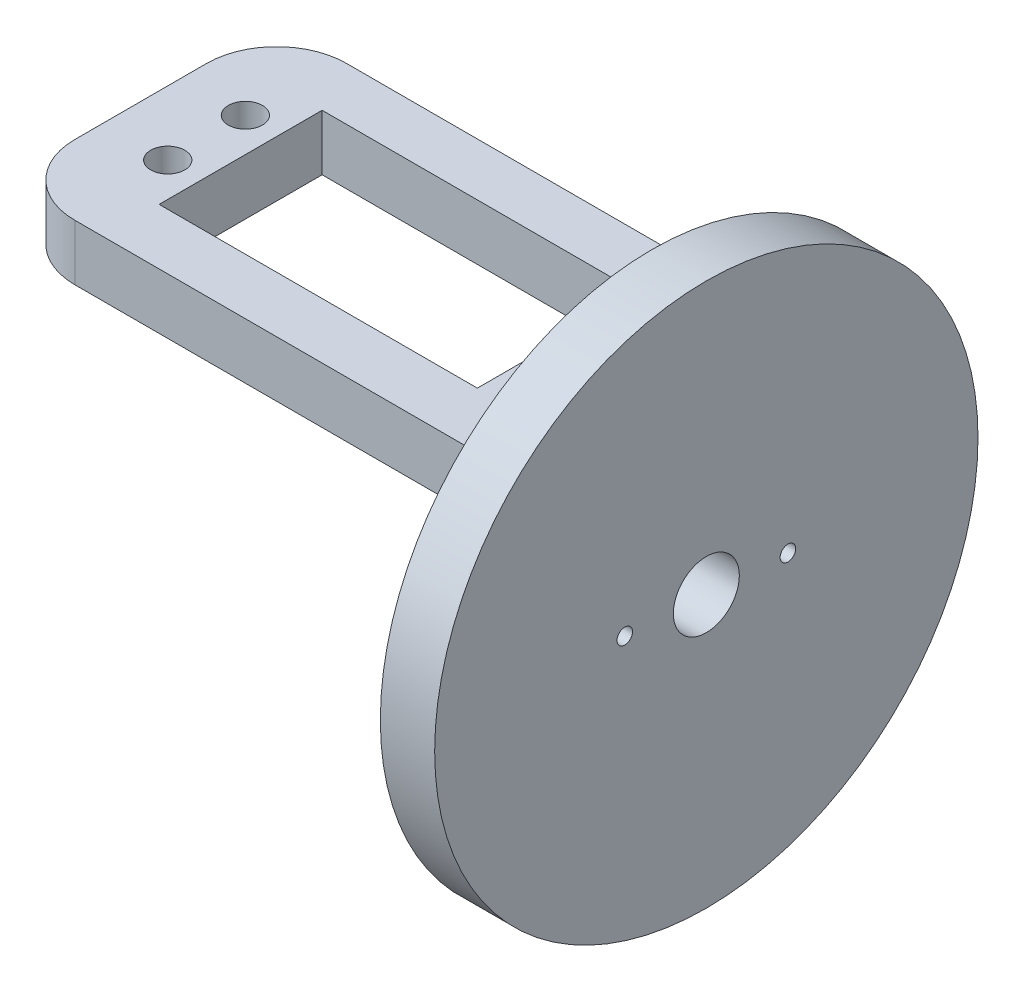
from build123d import *

# Parameters (mm, degrees)
SKETCH1_W           = 65
SKETCH1_H           = 35
BOSS_EXTRUDE1_DEPTH = 7.2
FILLET1_R           = 9
SKETCH5_R           = 2.25
SKETCH5_R_2         = 0.8
CUT_EXTRUDE1_DEPTH  = 52.716073838
SKETCH7_R           = 35
BOSS_EXTRUDE2_DEPTH = 7
CUT_EXTRUDE3_REACH  = 89.651
SKETCH8_R           = 4.25
SKETCH8_R_2         = 1
CUT_EXTRUDE4_REACH  = 82.469
SKETCH9_R           = 2.192172412
SKETCH9_R_2         = 2.2
SKETCH9_W           = 41
SKETCH9_H           = 21


with BuildPart() as part:
    # Sketch1 → Boss-Extrude1 (new body)
    with BuildSketch(Plane(origin=(0, 0, 0), x_dir=(1, 0, 0), z_dir=(0, 1, 0))):
        with Locations((-15.305107108, -0.868016429)):
            Rectangle(SKETCH1_W, SKETCH1_H)
    extrude(amount=BOSS_EXTRUDE1_DEPTH)

    # Fillet1
    fillet1_edges = [part.edges().sort_by_distance(p)[0] for p in [
        (-47.805107108, 3.6, -16.631983571),
        (-47.805107108, 3.6, 18.368016429),
    ]]
    fillet(fillet1_edges, radius=FILLET1_R)

    # Sketch5 → Cut-Extrude1 (cut, through all)
    with BuildSketch(Plane(origin=(0, 7.2, 0), x_dir=(1, 0, 0), z_dir=(0, 1, 0))):
        with Locations(Location((-24.935816815, -0.668016429, 0), (0, 0, 270))):
            Circle(SKETCH5_R)
        with Locations(Location((-28.935816815, -0.669860131, 0), (0, 0, 270))):
            Circle(SKETCH5_R_2)
        with Locations(Location((-20.935816815, -0.669860131, 0), (0, 0, 270))):
            Circle(SKETCH5_R_2)
    extrude(amount=-CUT_EXTRUDE1_DEPTH, mode=Mode.SUBTRACT)

    # Sketch7 → Boss-Extrude2 (add)
    with BuildSketch(Plane(origin=(17.194892892, 0, 0), x_dir=(0, 0, -1), z_dir=(1, 0, 0))):
        with Locations((0, -12.251447975)):
            Circle(SKETCH7_R)
    extrude(amount=BOSS_EXTRUDE2_DEPTH)

    # Sketch8 → Cut-Extrude3 (cut, up to next)
    with BuildSketch(Plane.ZY.offset(-17.194892892), mode=Mode.PRIVATE) as cut_extrude3_sk1:
        with Locations((0, -12.251447975)):
            Circle(SKETCH8_R)
    cut_extrude3_tool1 = extrude(cut_extrude3_sk1.sketch, amount=-CUT_EXTRUDE3_REACH, mode=Mode.PRIVATE) & part.part
    # Sketch8 → Cut-Extrude3 (cut, up to next)
    with BuildSketch(Plane.ZY.offset(-17.194892892), mode=Mode.PRIVATE) as cut_extrude3_sk2:
        with Locations((-10.511534724, -12.874775935)):
            Circle(SKETCH8_R_2)
    cut_extrude3_tool2 = extrude(cut_extrude3_sk2.sketch, amount=-CUT_EXTRUDE3_REACH, mode=Mode.PRIVATE) & part.part
    # Sketch8 → Cut-Extrude3 (cut, up to next)
    with BuildSketch(Plane.ZY.offset(-17.194892892), mode=Mode.PRIVATE) as cut_extrude3_sk3:
        with Locations((10.511534724, -11.628120014)):
            Circle(SKETCH8_R_2)
    cut_extrude3_tool3 = extrude(cut_extrude3_sk3.sketch, amount=-CUT_EXTRUDE3_REACH, mode=Mode.PRIVATE) & part.part
    add(cut_extrude3_tool1.solids().sort_by_distance((17.194893, -12.251448, 0))[0], mode=Mode.SUBTRACT)
    add(cut_extrude3_tool2.solids().sort_by_distance((17.194893, -12.874776, -10.511535))[0], mode=Mode.SUBTRACT)
    add(cut_extrude3_tool3.solids().sort_by_distance((17.194893, -11.62812, 10.511535))[0], mode=Mode.SUBTRACT)

    # Sketch9 → Cut-Extrude4 (cut, up to next)
    with BuildSketch(Plane(origin=(0, 7.2, 0), x_dir=(1, 0, 0), z_dir=(0, 1, 0)), mode=Mode.PRIVATE) as cut_extrude4_sk1:
        with Locations(Location((10.257150233, 4.32491084, 0), (0, 0, 270))):
            Circle(SKETCH9_R)
    cut_extrude4_tool1 = extrude(cut_extrude4_sk1.sketch, amount=-CUT_EXTRUDE4_REACH, mode=Mode.PRIVATE) & part.part
    # Sketch9 → Cut-Extrude4 (cut, up to next)
    with BuildSketch(Plane(origin=(0, 7.2, 0), x_dir=(1, 0, 0), z_dir=(0, 1, 0)), mode=Mode.PRIVATE) as cut_extrude4_sk2:
        with Locations(Location((10.253796486, -5.668016429, 0), (0, 0, 270))):
            Circle(SKETCH9_R_2)
    cut_extrude4_tool2 = extrude(cut_extrude4_sk2.sketch, amount=-CUT_EXTRUDE4_REACH, mode=Mode.PRIVATE) & part.part
    # Sketch9 → Cut-Extrude4 (cut, up to next)
    with BuildSketch(Plane(origin=(0, 7.2, 0), x_dir=(1, 0, 0), z_dir=(0, 1, 0)), mode=Mode.PRIVATE) as cut_extrude4_sk3:
        with Locations(Location((-39.525430116, -5.668016429, 0), (0, 0, 270))):
            Circle(SKETCH9_R_2)
    cut_extrude4_tool3 = extrude(cut_extrude4_sk3.sketch, amount=-CUT_EXTRUDE4_REACH, mode=Mode.PRIVATE) & part.part
    # Sketch9 → Cut-Extrude4 (cut, up to next)
    with BuildSketch(Plane(origin=(0, 7.2, 0), x_dir=(1, 0, 0), z_dir=(0, 1, 0)), mode=Mode.PRIVATE) as cut_extrude4_sk4:
        with Locations(Location((-39.525430116, 4.331983571, 0), (0, 0, 270))):
            Circle(SKETCH9_R_2)
    cut_extrude4_tool4 = extrude(cut_extrude4_sk4.sketch, amount=-CUT_EXTRUDE4_REACH, mode=Mode.PRIVATE) & part.part
    # Sketch9 → Cut-Extrude4 (cut, up to next)
    with BuildSketch(Plane(origin=(0, 7.2, 0), x_dir=(1, 0, 0), z_dir=(0, 1, 0)), mode=Mode.PRIVATE) as cut_extrude4_sk5:
        with Locations((-14.635816815, -0.668016429)):
            Rectangle(SKETCH9_W, SKETCH9_H)
    cut_extrude4_tool5 = extrude(cut_extrude4_sk5.sketch, amount=-CUT_EXTRUDE4_REACH, mode=Mode.PRIVATE) & part.part
    add(cut_extrude4_tool1.solids().sort_by_distance((10.25715, 7.2, -4.324911))[0], mode=Mode.SUBTRACT)
    add(cut_extrude4_tool2.solids().sort_by_distance((10.253796, 7.2, 5.668016))[0], mode=Mode.SUBTRACT)
    add(cut_extrude4_tool3.solids().sort_by_distance((-39.52543, 7.2, 5.668016))[0], mode=Mode.SUBTRACT)
    add(cut_extrude4_tool4.solids().sort_by_distance((-39.52543, 7.2, -4.331984))[0], mode=Mode.SUBTRACT)
    add(cut_extrude4_tool5.solids().sort_by_distance((-14.635817, 7.2, 0.668016))[0], mode=Mode.SUBTRACT)


solid = part.part
